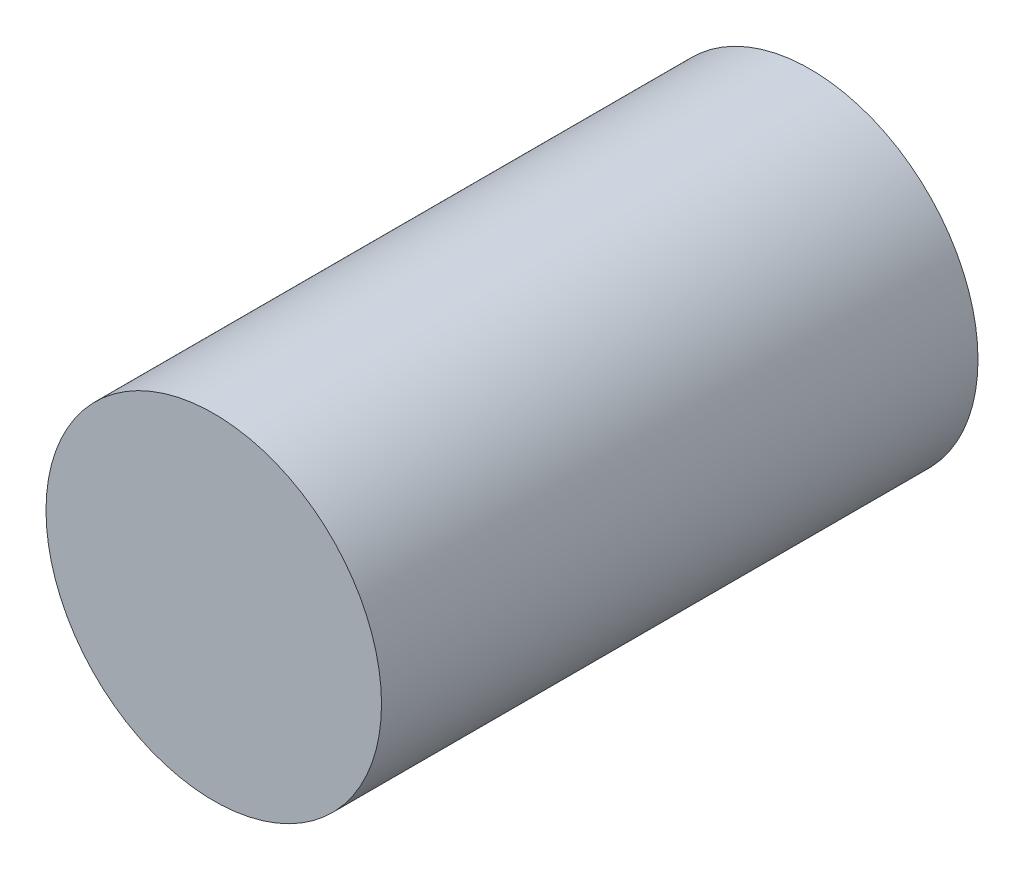
from build123d import *

# Parameters (mm, degrees)
SKETCH1_R           = 14.2875
BOSS_EXTRUDE1_DEPTH = 50.8


with BuildPart() as part:
    # Sketch1 → Boss-Extrude1 (new body)
    with BuildSketch(Plane.XY):
        Circle(SKETCH1_R)
    extrude(amount=BOSS_EXTRUDE1_DEPTH)


solid = part.part
